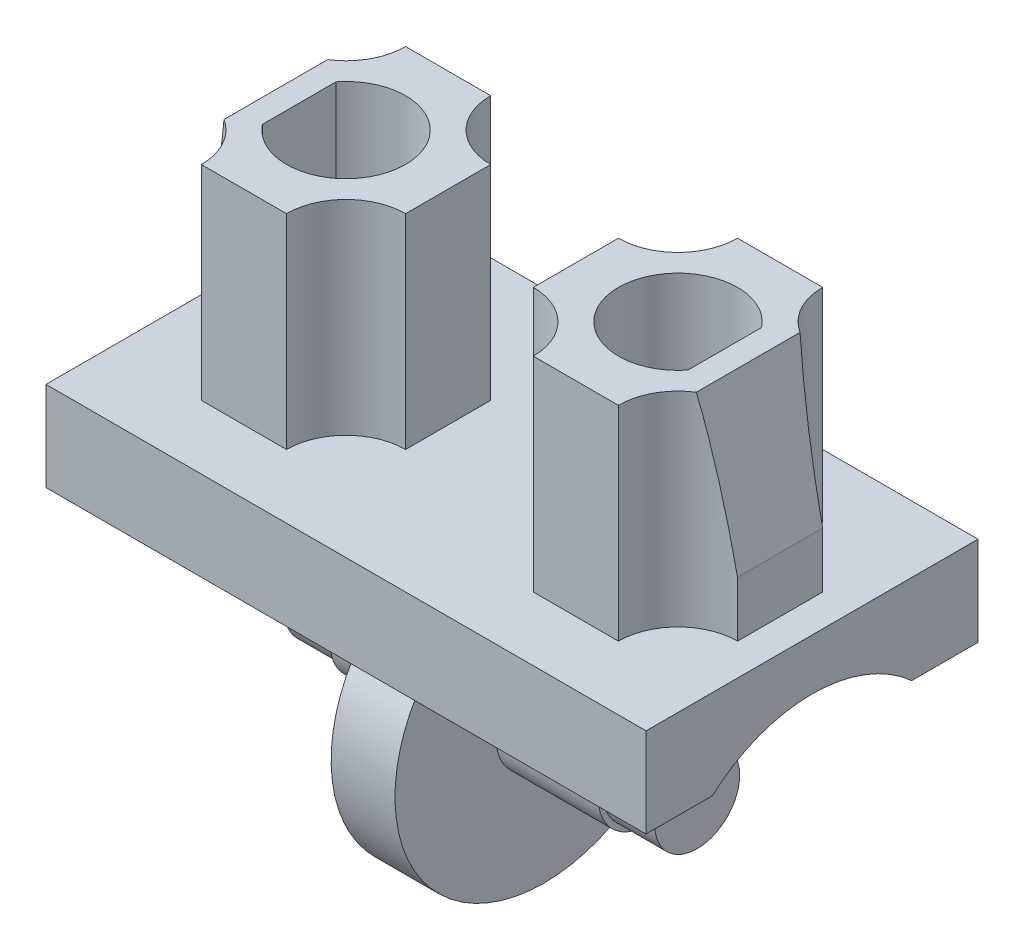
from build123d import *

# Parameters (mm, degrees)
SKETCH1_W           = 14.1
SKETCH1_H           = 7.8
BOSS_EXTRUDE1_DEPTH = 1.05
BOSS_EXTRUDE2_DEPTH = 2.4
CUT_EXTRUDE1_REACH  = 12.608
SKETCH3_R           = 1.4
CUT_EXTRUDE2_DEPTH  = 4.8
SKETCH5_R           = 3.5
BOSS_EXTRUDE3_DEPTH = 0.75
SKETCH6_R           = 1.125
BOSS_EXTRUDE4_DEPTH = 2.4
SKETCH7_R           = 1
BOSS_EXTRUDE5_DEPTH = 1.2
CUT_EXTRUDE3_START  = -6.3
CUT_EXTRUDE3_DEPTH  = 6.3
CUT_EXTRUDE4_DEPTH  = 6.3


with BuildPart() as part:
    # Sketch1 → Boss-Extrude1 (new, symmetric)
    with BuildSketch(Plane(origin=(0, 0, 0), x_dir=(1, 0, 0), z_dir=(0, 1, 0))):
        Rectangle(SKETCH1_W, SKETCH1_H)
    extrude(amount=BOSS_EXTRUDE1_DEPTH, both=True)

    # Sketch2 → Boss-Extrude2 (add, symmetric)
    with BuildSketch(Plane.XY):
        Polygon((-6.3, 1.05), (-6.3, 2.35), (-5.55, 5.85), (-1.5, 5.85), (-1.5, 1.05), align=None)
    boss_extrude2 = extrude(amount=BOSS_EXTRUDE2_DEPTH, both=True)

    # Cut-Extrude1: up to this face of the body (flat: up to its plane)
    cut_extrude1_end = Plane(part.part.faces().sort_by_distance((1.033540373, 1.05, 0))[0])
    # Sketch3 → Cut-Extrude1 (cut, up to the picked face)
    with BuildSketch(Plane(origin=(0, 5.85, 0), x_dir=(1, 0, 0), z_dir=(0, 1, 0)), mode=Mode.PRIVATE) as cut_extrude1_sk1:
        with Locations((-1.5, 2.4)):
            Circle(SKETCH3_R)
    cut_extrude1_tool1 = split(extrude(cut_extrude1_sk1.sketch, amount=-CUT_EXTRUDE1_REACH, mode=Mode.PRIVATE), bisect_by=cut_extrude1_end, keep=Keep.BOTH, mode=Mode.PRIVATE)
    # Sketch3 → Cut-Extrude1 (cut, up to the picked face)
    with BuildSketch(Plane(origin=(0, 5.85, 0), x_dir=(1, 0, 0), z_dir=(0, 1, 0)), mode=Mode.PRIVATE) as cut_extrude1_sk2:
        with Locations((-1.5, -2.4)):
            Circle(SKETCH3_R)
    cut_extrude1_tool2 = split(extrude(cut_extrude1_sk2.sketch, amount=-CUT_EXTRUDE1_REACH, mode=Mode.PRIVATE), bisect_by=cut_extrude1_end, keep=Keep.BOTH, mode=Mode.PRIVATE)
    # Sketch3 → Cut-Extrude1 (cut, up to the picked face)
    with BuildSketch(Plane(origin=(0, 5.85, 0), x_dir=(1, 0, 0), z_dir=(0, 1, 0)), mode=Mode.PRIVATE) as cut_extrude1_sk3:
        with Locations((-6.3, 2.4)):
            Circle(SKETCH3_R)
    cut_extrude1_tool3 = split(extrude(cut_extrude1_sk3.sketch, amount=-CUT_EXTRUDE1_REACH, mode=Mode.PRIVATE), bisect_by=cut_extrude1_end, keep=Keep.BOTH, mode=Mode.PRIVATE)
    # Sketch3 → Cut-Extrude1 (cut, up to the picked face)
    with BuildSketch(Plane(origin=(0, 5.85, 0), x_dir=(1, 0, 0), z_dir=(0, 1, 0)), mode=Mode.PRIVATE) as cut_extrude1_sk4:
        with Locations((-6.3, -2.4)):
            Circle(SKETCH3_R)
    cut_extrude1_tool4 = split(extrude(cut_extrude1_sk4.sketch, amount=-CUT_EXTRUDE1_REACH, mode=Mode.PRIVATE), bisect_by=cut_extrude1_end, keep=Keep.BOTH, mode=Mode.PRIVATE)
    cut_extrude1_1 = cut_extrude1_tool1.solids().sort_by(Axis((-1.5, 5.85, -2.4), (0, -1, 0)))[0]
    add(cut_extrude1_1, mode=Mode.SUBTRACT)
    cut_extrude1_2 = cut_extrude1_tool2.solids().sort_by(Axis((-1.5, 5.85, 2.4), (0, -1, 0)))[0]
    add(cut_extrude1_2, mode=Mode.SUBTRACT)
    cut_extrude1_3 = cut_extrude1_tool3.solids().sort_by(Axis((-6.3, 5.85, -2.4), (0, -1, 0)))[0]
    add(cut_extrude1_3, mode=Mode.SUBTRACT)
    cut_extrude1_4 = cut_extrude1_tool4.solids().sort_by(Axis((-6.3, 5.85, 2.4), (0, -1, 0)))[0]
    add(cut_extrude1_4, mode=Mode.SUBTRACT)
    cut_extrude1 = cut_extrude1_1 + cut_extrude1_2 + cut_extrude1_3 + cut_extrude1_4  # Cut-Extrude1 as one shape, for the pattern or mirror that repeats it

    # Sketch4 → Cut-Extrude2 (cut)
    with BuildSketch(Plane(origin=(0, 5.85, 0), x_dir=(1, 0, 0), z_dir=(0, 1, 0))):
        with BuildLine():
            Line((-5, 0.866025404), (-5, -0.866025404))
            ThreePointArc((-5, -0.866025404), (-2.5, 0), (-5, 0.866025404))
        make_face()
    cut_extrude2 = extrude(amount=-CUT_EXTRUDE2_DEPTH, mode=Mode.SUBTRACT)

    # Mirror1: Boss-Extrude2, Cut-Extrude1, Cut-Extrude2 across plane
    add(boss_extrude2.mirror(Plane(origin=(0, 0, 0), x_dir=(0, 0, 1), z_dir=(1, 0, 0))))
    add(cut_extrude1.mirror(Plane(origin=(0, 0, 0), x_dir=(0, 0, 1), z_dir=(1, 0, 0))), mode=Mode.SUBTRACT)
    add(cut_extrude2.mirror(Plane(origin=(0, 0, 0), x_dir=(0, 0, 1), z_dir=(1, 0, 0))), mode=Mode.SUBTRACT)

    # Sketch5 → Boss-Extrude3 (add, symmetric)
    with BuildSketch(Plane(origin=(0, 0, 0), x_dir=(0, 0, -1), z_dir=(1, 0, 0))):
        with Locations((0, -3.65)):
            Circle(SKETCH5_R)
    extrude(amount=BOSS_EXTRUDE3_DEPTH, both=True)

    # Sketch6 → Boss-Extrude4 (add)
    with BuildSketch(Plane(origin=(0.75, 0, 0), x_dir=(0, 0, -1), z_dir=(1, 0, 0))):
        with Locations((0, -3.65)):
            Circle(SKETCH6_R)
    boss_extrude4 = extrude(amount=BOSS_EXTRUDE4_DEPTH)

    # Mirror2: Boss-Extrude4 across plane
    add(boss_extrude4.mirror(Plane(origin=(0, 0, 0), x_dir=(0, 0, 1), z_dir=(1, 0, 0))))

    # Sketch7 → Boss-Extrude5 (add)
    with BuildSketch(Plane(origin=(3.15, 0, 0), x_dir=(0, 0, -1), z_dir=(1, 0, 0))):
        with Locations((0, -3.65)):
            Circle(SKETCH7_R)
    boss_extrude5 = extrude(amount=BOSS_EXTRUDE5_DEPTH)

    # Mirror3: Boss-Extrude5 across plane
    add(boss_extrude5.mirror(Plane(origin=(0, 0, 0), x_dir=(0, 0, 1), z_dir=(1, 0, 0))))

    # Sketch8 → Cut-Extrude3 (cut)
    with BuildSketch(Plane.ZY.offset(7.05).offset(CUT_EXTRUDE3_START)):
        with BuildLine():
            Line((-2.343074903, -1.05), (2.343074903, -1.05))
            ThreePointArc((2.343074903, -1.05), (0, -0.15), (-2.343074903, -1.05))
        make_face()
    extrude(amount=CUT_EXTRUDE3_DEPTH, mode=Mode.SUBTRACT)

    # Sketch9 → Cut-Extrude4 (cut)
    with BuildSketch(Plane(origin=(7.05, 0, 0), x_dir=(0, 0, -1), z_dir=(1, 0, 0))):
        with BuildLine():
            Line((-2.343074903, -1.05), (2.343074903, -1.05))
            ThreePointArc((2.343074903, -1.05), (0, -0.15), (-2.343074903, -1.05))
        make_face()
    extrude(amount=-CUT_EXTRUDE4_DEPTH, mode=Mode.SUBTRACT)


solid = part.part
